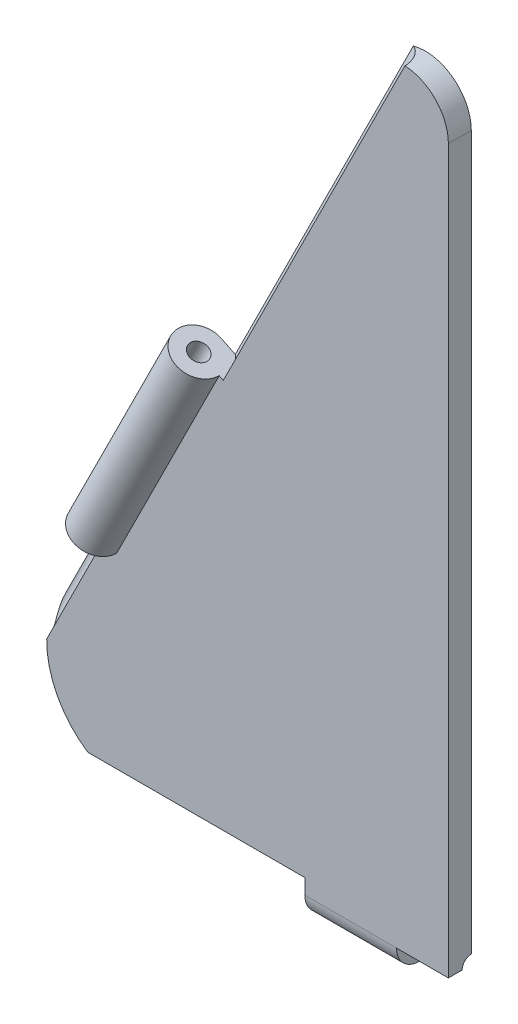
from build123d import *

# Parameters (mm, degrees)
EXTRUDE_1_DEPTH          = 5
SKETCH_5_W               = 5
SKETCH_5_H               = 50
SKETCH_2_W               = 20
SKETCH_2_H               = 5
CUT_EXTRUDE_2_DEPTH      = 698.009362047
CUT_EXTRUDE_2_DEPTH_BACK = 698.009362047
SKETCH_8_R               = 2
SKETCH_12_R              = 6
SKETCH_12_R_2            = 2
CUT_EXTRUDE_6_DEPTH      = 346.897812083
CUT_EXTRUDE_7_DEPTH      = 346.897812083
CUT_EXTRUDE_7_DEPTH_BACK = 346.897812083
SKETCH_13_R              = 2
SKETCH_11_R              = 6
CUT_EXTRUDE_5_DEPTH      = 692.343248918
SCALE_1_SCALE            = 0.5


with BuildPart() as part:
    # 草图1 → 凸台-拉伸1 (new body)
    with BuildSketch(Plane.XY.offset(5)):
        with BuildLine():
            Line((-531.259329651, 335.424320593), (-597.842921786, 202.257136323))
            ThreePointArc((-597.842921786, 202.257136323), (-596.967394134, 182.798242171), (-579.954377966, 173.312864413))
            Line((-579.954377966, 173.312864413), (-512.315057741, 173.312864413))
            Line((-512.315057741, 173.312864413), (-512.315057741, 330.952184638))
            ThreePointArc((-512.315057741, 330.952184638), (-520.017528536, 340.684674533), (-531.259329651, 335.424320593))
        make_face()
    extrude(amount=EXTRUDE_1_DEPTH)

    # 草图5 → 旋转1 (revolve)
    with BuildSketch(Plane(origin=(-559.177191958, 279.588595979, 0), x_dir=(0, 0, 1), z_dir=(-0.894427190999916, 0.4472135954999578, 0))):
        with Locations((7.5, -42.016481195)):
            Rectangle(SKETCH_5_W, SKETCH_5_H)
    revolve(axis=Axis((-566.787193696, 264.368592503, 10), (-0.4472135954999577, -0.894427190999916, 0)))

    # 草图2 → 旋转2 (revolve)
    with BuildSketch(Plane.XZ.offset(-173.312864413)):
        with Locations((-533.634717854, 7.5)):
            Rectangle(SKETCH_2_W, SKETCH_2_H)
    revolve(axis=Axis((-543.634717854, 173.312864413, 5), (1, 0, 0)))

    # 草图8 → 切除-拉伸2 (cut, two sides: drawn at the far end of the back side and taken through both)
    with BuildSketch(Plane(origin=(-29.970681513, -59.941363026, 0), x_dir=(0.894427190999916, -0.4472135954999577, 0), z_dir=(-0.4472135954999577, -0.894427190999916, 0)).offset(-CUT_EXTRUDE_2_DEPTH_BACK)):
        with Locations((-625.179106343, 10)):
            Circle(SKETCH_8_R)
    extrude(amount=CUT_EXTRUDE_2_DEPTH + CUT_EXTRUDE_2_DEPTH_BACK, mode=Mode.SUBTRACT)

    # 草图12 → 切除-拉伸6 (cut, through all)
    with BuildSketch(Plane.ZY.offset(543.634717854)):
        with Locations((5, 173.312864413)):
            Circle(SKETCH_12_R)
        with Locations((5, 173.312864413)):
            Circle(SKETCH_12_R_2, mode=Mode.SUBTRACT)
    extrude(amount=CUT_EXTRUDE_6_DEPTH, mode=Mode.SUBTRACT)

    # 草图13 → 切除-拉伸7 (cut, two sides: drawn at the far end of the back side and taken through both)
    with BuildSketch(Plane.ZY.offset(543.634717854).offset(-CUT_EXTRUDE_7_DEPTH_BACK)):
        with Locations((5, 173.312864413)):
            Circle(SKETCH_13_R)
    extrude(amount=CUT_EXTRUDE_7_DEPTH + CUT_EXTRUDE_7_DEPTH_BACK, mode=Mode.SUBTRACT)

    # 草图11 → 切除-拉伸5 (cut, through all)
    with BuildSketch(Plane(origin=(-7.610001738, -15.220003476, 0), x_dir=(0.8944271909999161, -0.4472135954999577, 0), z_dir=(0.4472135954999577, 0.8944271909999161, 0))):
        with Locations((-625.179106343, -10)):
            Circle(SKETCH_11_R)
    extrude(amount=CUT_EXTRUDE_5_DEPTH, mode=Mode.SUBTRACT)


with BuildPart() as part_1:
    # 缩放比例1: scaled about (0, 0, 0)
    add(part.part.scale(SCALE_1_SCALE))


solid = part_1.part
